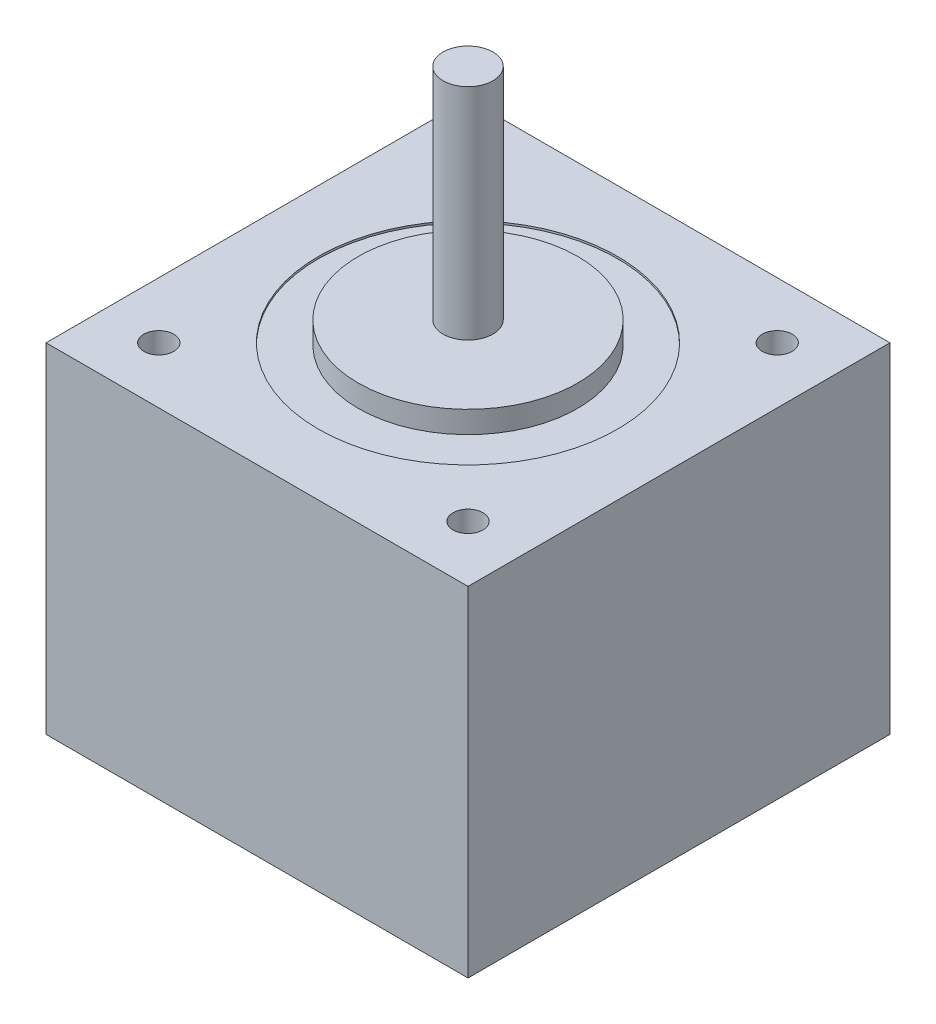
from build123d import *

# Parameters (mm, degrees)
SKETCH1_W            = 42.3
SKETCH1_H            = 42.3
BODY_DEPTH           = 34
SKETCH2_R            = 1.5
MOUNTING_HOLES_DEPTH = 4
SKETCH3_R            = 11
CENTER_THING_DEPTH   = 2
SKETCH4_R            = 2.5
SHAFT_DEPTH          = 22
LARGE_DIVOT_START    = -0.2
SKETCH5_R            = 15
SKETCH5_R_2          = 11
LARGE_DIVOT_DEPTH    = 0.2


with BuildPart() as part:
    # Sketch1 → body (new body)
    with BuildSketch(Plane(origin=(0, 0, 0), x_dir=(1, 0, 0), z_dir=(0, 1, 0))):
        Rectangle(SKETCH1_W, SKETCH1_H)
    extrude(amount=BODY_DEPTH)

    # Sketch2 → mounting-holes (cut)
    with BuildSketch(Plane(origin=(0, 34, 0), x_dir=(1, 0, 0), z_dir=(0, 1, 0))):
        with Locations(Location((-15.5, 15.5, 0), (0, 0, 270))):
            Circle(SKETCH2_R)
        with Locations(Location((15.5, 15.5, 0), (0, 0, 270))):
            Circle(SKETCH2_R)
        with Locations(Location((15.5, -15.5, 0), (0, 0, 270))):
            Circle(SKETCH2_R)
        with Locations(Location((-15.5, -15.5, 0), (0, 0, 270))):
            Circle(SKETCH2_R)
    extrude(amount=-MOUNTING_HOLES_DEPTH, mode=Mode.SUBTRACT)

    # Sketch3 → center-thing (add)
    with BuildSketch(Plane(origin=(0, 34, 0), x_dir=(1, 0, 0), z_dir=(0, 1, 0))):
        with Locations(Location((0, 0, 0), (0, 0, 270))):
            Circle(SKETCH3_R)
    extrude(amount=CENTER_THING_DEPTH)

    # Sketch4 → shaft (add)
    with BuildSketch(Plane(origin=(0, 36, 0), x_dir=(1, 0, 0), z_dir=(0, 1, 0))):
        with Locations(Location((0, 0, 0), (0, 0, 270))):
            Circle(SKETCH4_R)
    extrude(amount=SHAFT_DEPTH)

    # Sketch5 → large-divot (cut)
    with BuildSketch(Plane(origin=(0, 34, 0), x_dir=(1, 0, 0), z_dir=(0, 1, 0)).offset(LARGE_DIVOT_START)):
        with Locations(Location((0, 0, 0), (0, 0, 270))):
            Circle(SKETCH5_R)
        with Locations(Location((0, 0, 0), (0, 0, 270))):
            Circle(SKETCH5_R_2, mode=Mode.SUBTRACT)
    extrude(amount=LARGE_DIVOT_DEPTH, mode=Mode.SUBTRACT)


solid = part.part
